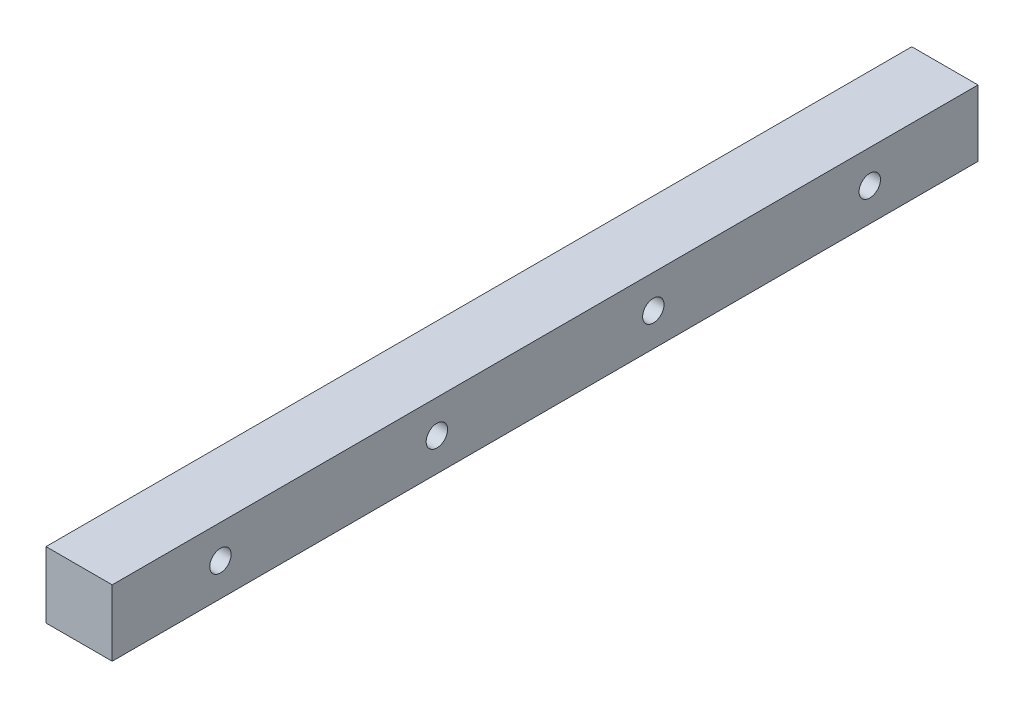
from build123d import *

# Parameters (mm, degrees)
SKETCH1_W           = 13
SKETCH1_H           = 13
BOSS_EXTRUDE1_DEPTH = 85
SKETCH2_R           = 2.1
CUT_EXTRUDE1_DEPTH  = 11.5
SKETCH3_R           = 5.25
CUT_EXTRUDE2_DEPTH  = 4.5


with BuildPart() as part:
    # Sketch1 → Boss-Extrude1 (new, symmetric)
    with BuildSketch(Plane.XY):
        Rectangle(SKETCH1_W, SKETCH1_H)
    extrude(amount=BOSS_EXTRUDE1_DEPTH, both=True)

    # Sketch2 → Cut-Extrude1 (cut, symmetric)
    with BuildSketch(Plane(origin=(0, 0, 0), x_dir=(0, 0, -1), z_dir=(1, 0, 0))):
        with Locations((63.75, 0)):
            Circle(SKETCH2_R)
        with Locations((21.25, 0)):
            Circle(SKETCH2_R)
        with Locations((-21.25, 0)):
            Circle(SKETCH2_R)
        with Locations((-63.75, 0)):
            Circle(SKETCH2_R)
    extrude(amount=CUT_EXTRUDE1_DEPTH, both=True, mode=Mode.SUBTRACT)

    # Sketch3 → Cut-Extrude2 (cut, symmetric)
    with BuildSketch(Plane(origin=(-6.5, 0, 0), x_dir=(0, 0, -1), z_dir=(1, 0, 0))):
        with Locations((63.75, 0)):
            Circle(SKETCH3_R)
        with Locations((21.25, 0)):
            Circle(SKETCH3_R)
        with Locations((-21.25, 0)):
            Circle(SKETCH3_R)
        with Locations((-63.75, 0)):
            Circle(SKETCH3_R)
    extrude(amount=CUT_EXTRUDE2_DEPTH, both=True, mode=Mode.SUBTRACT)


solid = part.part
